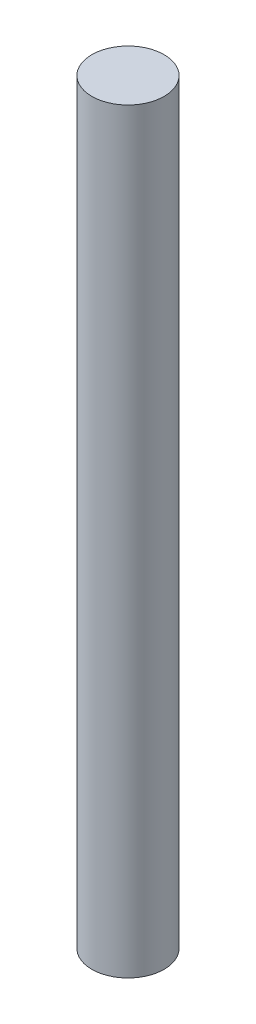
from build123d import *

# Parameters (mm, degrees)
SKETCH1_R           = 7.9375
BOSS_EXTRUDE1_DEPTH = 166


with BuildPart() as part:
    # Sketch1 → Boss-Extrude1 (new body)
    with BuildSketch(Plane(origin=(0, 0, 0), x_dir=(1, 0, 0), z_dir=(0, 1, 0))):
        Circle(SKETCH1_R)
    extrude(amount=BOSS_EXTRUDE1_DEPTH)


solid = part.part
